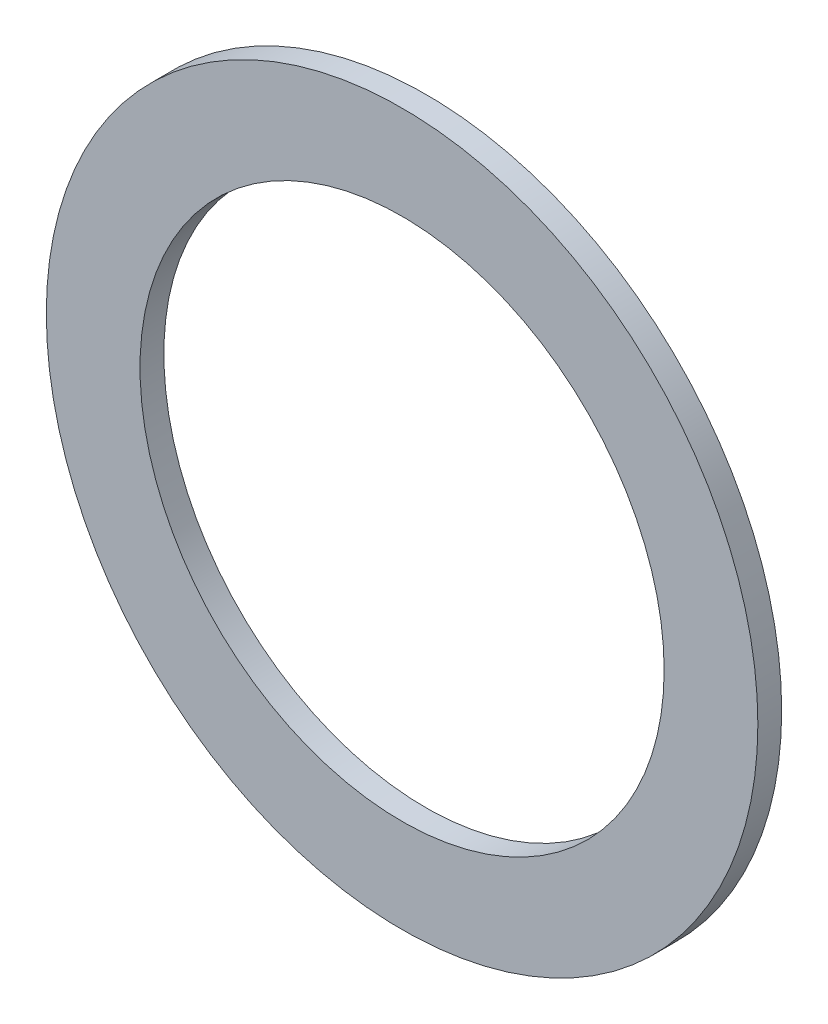
from build123d import *

# Parameters (mm, degrees)
ESQUISSE1_R        = 44.8
ESQUISSE1_R_2      = 33
BOSS_EXTRU_1_DEPTH = 3


with BuildPart() as part:
    # Esquisse1 → Boss.-Extru.1 (new body)
    with BuildSketch(Plane.XY):
        Circle(ESQUISSE1_R)
        Circle(ESQUISSE1_R_2, mode=Mode.SUBTRACT)
    extrude(amount=BOSS_EXTRU_1_DEPTH)


solid = part.part
